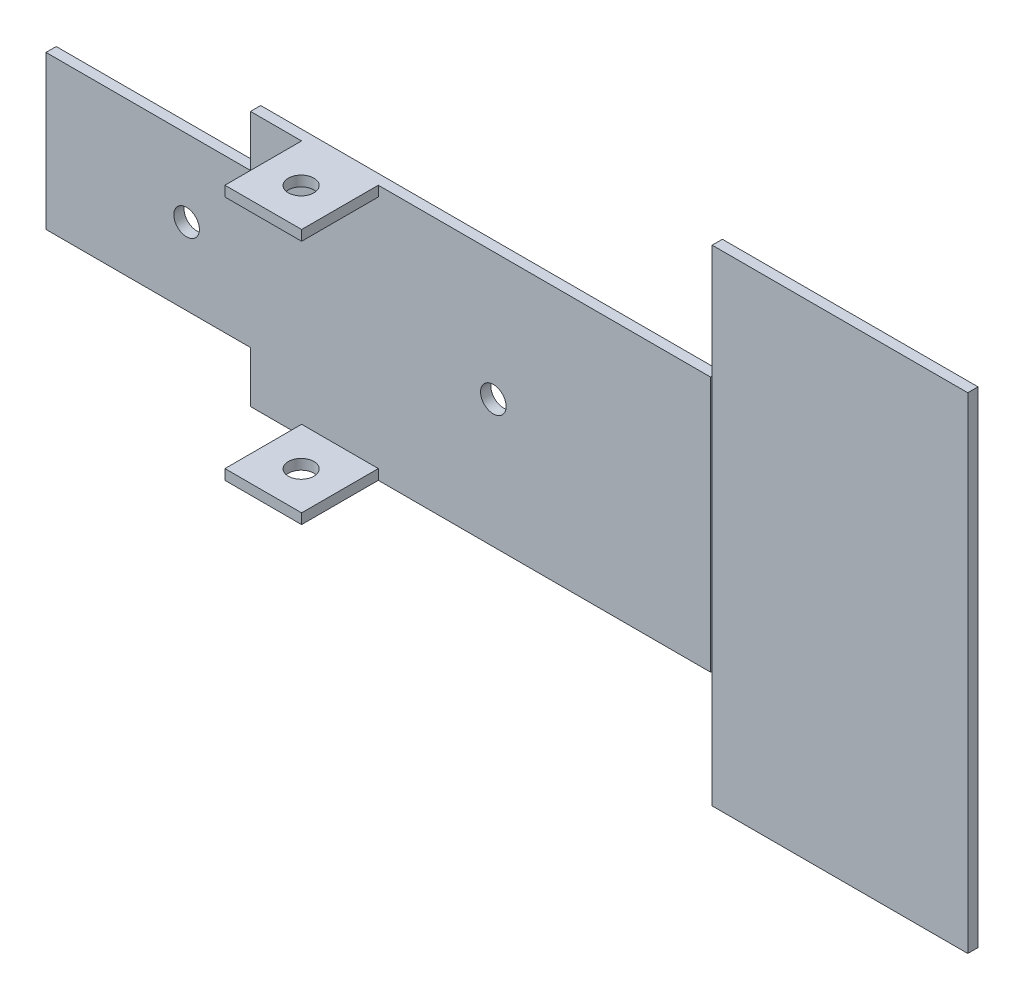
from build123d import *

# Parameters (mm, degrees)
BOSS_EXTRUDE1_DEPTH   = 2
SKETCH1_W             = 50
SKETCH1_H             = 95
BOSS_EXTRUDE1_2_DEPTH = 2
SKETCH1_4_W           = 15
SKETCH1_4_H           = 2
BOSS_EXTRUDE2_DEPTH   = 17
SKETCH2_R             = 2.5
SKETCH2_W             = 40
SKETCH2_H             = 10
CUT_EXTRUDE1_DEPTH    = 4
SKETCH3_R             = 2.5
CUT_EXTRUDE2_DEPTH    = 138.262677829


with BuildPart() as part:
    # Sketch1 → Boss-Extrude1 (new body)
    with BuildSketch(Plane.XY):
        Polygon((-65, 25), (-65, -25), (-15, -25), (-15, -23), (0, -23), (0, -25), (65, -25), (65, 25), (0, 25), (0, 23), (-15, 23), (-15, 25), align=None)
    extrude(amount=BOSS_EXTRUDE1_DEPTH)

    # Sketch1<4> → Boss-Extrude2 (add)
    with BuildSketch(Plane.XY):
        with Locations((-7.5, -24)):
            Rectangle(SKETCH1_4_W, SKETCH1_4_H)
        with Locations((-7.5, 24)):
            Rectangle(SKETCH1_4_W, SKETCH1_4_H)
    extrude(amount=BOSS_EXTRUDE2_DEPTH)

    # Sketch2 → Cut-Extrude1 (cut)
    with BuildSketch(Plane.XY.offset(2)):
        with Locations((-37.5, 0)):
            Circle(SKETCH2_R)
        with Locations((22.5, 0)):
            Circle(SKETCH2_R)
        with Locations((-45, -20)):
            Rectangle(SKETCH2_W, SKETCH2_H)
        with Locations((-45, 20)):
            Rectangle(SKETCH2_W, SKETCH2_H)
    extrude(amount=-CUT_EXTRUDE1_DEPTH, mode=Mode.SUBTRACT)

    # Sketch3 → Cut-Extrude2 (cut, through all)
    with BuildSketch(Plane(origin=(0, -25, 0), x_dir=(-1, 0, 0), z_dir=(0, -1, 0))):
        with Locations((7.5, -9.596652221)):
            Circle(SKETCH3_R)
    extrude(amount=-CUT_EXTRUDE2_DEPTH, mode=Mode.SUBTRACT)


with BuildPart() as body_2:
    # Sketch1 → Boss-Extrude1 2 (new body)
    with BuildSketch(Plane.XY):
        with Locations((90.307383653, 0)):
            Rectangle(SKETCH1_W, SKETCH1_H)
    extrude(amount=BOSS_EXTRUDE1_2_DEPTH)


solid = Compound([part.part, body_2.part])
